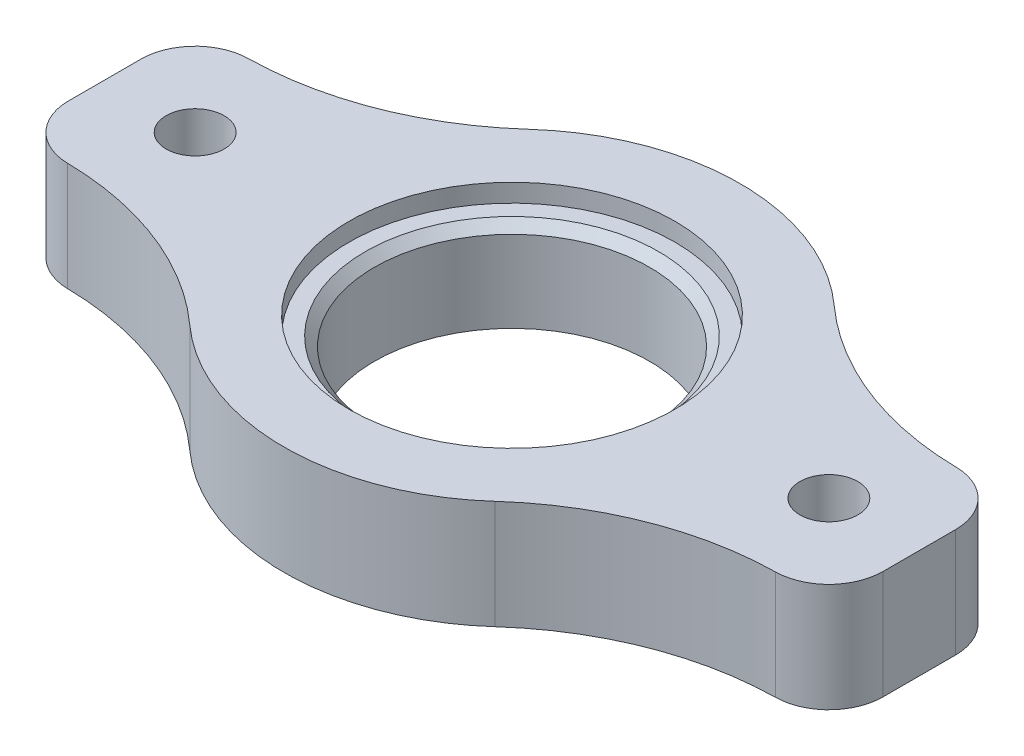
from build123d import *

# Parameters (mm, degrees)
SKETCH1_R           = 1.6000000000000016
BOSS_EXTRUDE1_DEPTH = 6
FILLET1_R           = 3
FILLET2_R           = 17
SKETCH2_R           = 9
CUT_EXTRUDE1_DEPTH  = 1
CHAMFER1_SIZE       = 0.5


with BuildPart() as part:
    # Sketch1 → Boss-Extrude1 (new body)
    # profile 1 of 8: a face of its own
    with BuildSketch(Plane(origin=(0, 0, 0), x_dir=(1, 0, 0), z_dir=(0, 1, 0))):
        with BuildLine():
            Line((-5.7236352085013955, -4.999999999999999), (-11.56546583584068, -5))
            ThreePointArc((-11.565465835840719, -5.000000000000114), (6.483e-14, -12.6), (11.565465835840772, -4.99999999999999))
            Line((11.565465835840783, -4.999999999999998), (5.7236352085012925, -4.999999999999999))
            ThreePointArc((5.723635208501399, -5.000000000000313), (-5.54e-14, -7.599999999999999), (-5.723635208501475, -5.0000000000002265))
        make_face()
    # profile 2 of 8: a face of its own
    with BuildSketch(Plane(origin=(0, 0, 0), x_dir=(1, 0, 0), z_dir=(0, 1, 0))):
        with BuildLine():
            Line((-11.56546583584068, 5), (-22.5, 5))
            Line((-22.5, 5), (-22.5, -5))
            Line((-22.5, -5), (-11.56546583584068, -5))
            ThreePointArc((-11.565465835840719, -5.000000000000114), (-12.6, 1.54e-15), (-11.565465835840715, 5.000000000000122))
        make_face()
        with Locations(Location((-17.499999999999996, 0, 0), (0, 0, 270))):
            Circle(SKETCH1_R, mode=Mode.SUBTRACT)
    # profile 3 of 8: a face of its own
    with BuildSketch(Plane(origin=(0, 0, 0), x_dir=(1, 0, 0), z_dir=(0, 1, 0))):
        with BuildLine():
            Line((-5.7236352085013955, 4.999999999999999), (-11.56546583584068, 5))
            ThreePointArc((-11.565465835840715, 5.000000000000122), (-12.6, 1.54e-15), (-11.565465835840719, -5.000000000000114))
            Line((-11.56546583584068, -5), (-5.7236352085013955, -4.999999999999999))
            ThreePointArc((-5.723635208501475, -5.0000000000002265), (-7.599999999999999, 9.3e-16), (-5.723635208501473, 5.000000000000228))
        make_face()
    # profile 4 of 8: a face of its own
    with BuildSketch(Plane(origin=(0, 0, 0), x_dir=(1, 0, 0), z_dir=(0, 1, 0))):
        with BuildLine():
            ThreePointArc((12.6, 0), (12.338656116684541, 2.5529522585044844), (11.56546583584077, 4.999999999999995))
            Line((11.565465835840769, 4.999999999999998), (5.723635208502053, 4.999999999999999))
            ThreePointArc((5.723635208501946, 4.9999999999996865), (7.115463006179385, 2.670240852000546), (7.599999999999999, 0))
            ThreePointArc((7.599999999999999, -1.86e-15), (7.11546300617924, -2.6702408520009326), (5.723635208501399, -5.000000000000313))
            Line((5.7236352085012925, -4.999999999999999), (11.565465835840783, -4.999999999999998))
            ThreePointArc((11.565465835840772, -4.99999999999999), (12.338656116684541, -2.552952258504483), (12.6, -3.09e-15))
        make_face()
    # profile 5 of 8: a face of its own
    with BuildSketch(Plane(origin=(0, 0, 0), x_dir=(1, 0, 0), z_dir=(0, 1, 0))):
        with BuildLine():
            ThreePointArc((11.56546583584077, 4.999999999999995), (7.072e-14, 12.6), (-11.565465835840715, 5.000000000000122))
            Line((-11.56546583584068, 5), (-5.7236352085013955, 4.999999999999999))
            ThreePointArc((-5.723635208501473, 5.000000000000228), (3.5822e-13, 7.599999999999999), (5.723635208501945, 4.999999999999687))
            Line((5.723635208502053, 4.999999999999999), (11.565465835840769, 4.999999999999998))
        make_face()
    # profile 6 of 8: a face of its own
    with BuildSketch(Plane(origin=(0, 0, 0), x_dir=(1, 0, 0), z_dir=(0, 1, 0))):
        with BuildLine():
            Line((-5.7236352085013955, 4.999999999999999), (-11.56546583584068, 5))
            ThreePointArc((-11.565465835840715, 5.000000000000122), (-12.6, 1.54e-15), (-11.565465835840719, -5.000000000000114))
            Line((-11.56546583584068, -5), (-5.7236352085013955, -4.999999999999999))
            ThreePointArc((-5.723635208501475, -5.0000000000002265), (-7.599999999999999, 9.3e-16), (-5.723635208501473, 5.000000000000228))
        make_face()
    # profile 7 of 8: a face of its own
    with BuildSketch(Plane(origin=(0, 0, 0), x_dir=(1, 0, 0), z_dir=(0, 1, 0))):
        with BuildLine():
            ThreePointArc((12.6, 0), (12.338656116684541, 2.5529522585044844), (11.56546583584077, 4.999999999999995))
            Line((11.565465835840769, 4.999999999999998), (5.723635208502053, 4.999999999999999))
            ThreePointArc((5.723635208501946, 4.9999999999996865), (7.115463006179385, 2.670240852000546), (7.599999999999999, 0))
            ThreePointArc((7.599999999999999, -1.86e-15), (7.11546300617924, -2.6702408520009326), (5.723635208501399, -5.000000000000313))
            Line((5.7236352085012925, -4.999999999999999), (11.565465835840783, -4.999999999999998))
            ThreePointArc((11.565465835840772, -4.99999999999999), (12.338656116684541, -2.552952258504483), (12.6, -3.09e-15))
        make_face()
    # profile 8 of 8: a face of its own
    with BuildSketch(Plane(origin=(0, 0, 0), x_dir=(1, 0, 0), z_dir=(0, 1, 0))):
        with BuildLine():
            Line((22.5, 4.999999999999998), (11.565465835840769, 4.999999999999998))
            ThreePointArc((11.56546583584077, 4.999999999999995), (12.338656116684541, 2.5529522585044844), (12.6, 0))
            ThreePointArc((12.6, -3.09e-15), (12.338656116684541, -2.552952258504483), (11.565465835840772, -4.99999999999999))
            Line((11.565465835840783, -4.999999999999998), (22.5, -4.999999999999998))
            Line((22.5, -4.999999999999998), (22.5, 4.999999999999998))
        make_face()
        with Locations(Location((17.499999999999996, 0, 0), (0, 0, 270))):
            Circle(SKETCH1_R, mode=Mode.SUBTRACT)
    extrude(amount=BOSS_EXTRUDE1_DEPTH)

    # Fillet1
    fillet1_edges = [part.edges().sort_by_distance(p)[0] for p in [
        (22.5, 3, -4.999999999999998),
        (22.5, 3, 4.999999999999998),
        (-22.5, 3, 5),
        (-22.5, 3, -5),
    ]]
    fillet(fillet1_edges, radius=FILLET1_R)

    # Fillet2
    fillet2_edges = [part.edges().sort_by_distance(p)[0] for p in [
        (11.56546583584077, 3, -4.9999999999999964),
        (-11.5654658358407, 3, -5.00000000000006),
        (11.565465835840776, 3, 4.999999999999994),
        (-11.5654658358407, 3, 5.000000000000057),
    ]]
    fillet(fillet2_edges, radius=FILLET2_R)

    # Sketch2 → Cut-Extrude1 (cut)
    with BuildSketch(Plane(origin=(0, 6, 0), x_dir=(1, 0, 0), z_dir=(0, 1, 0))):
        with Locations(Location((0, 0, 0), (0, 0, 270))):
            Circle(SKETCH2_R)
    extrude(amount=-CUT_EXTRUDE1_DEPTH, mode=Mode.SUBTRACT)

    # Chamfer1
    chamfer1_edges = [part.edges().sort_by_distance(p)[0] for p in [
        (-5.7236352085019595, 5, 4.999999999999671),
    ]]
    chamfer(chamfer1_edges, length=CHAMFER1_SIZE)


solid = part.part
